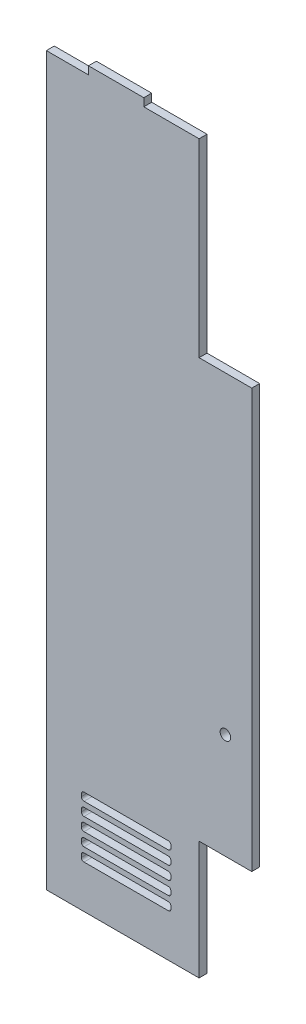
from build123d import *

# Parameters (mm, degrees)
SKETCH1_R           = 2
BOSS_EXTRUDE1_DEPTH = 3


with BuildPart() as part:
    # Sketch1 → Boss-Extrude1 (new body)
    with BuildSketch(Plane.XY):
        Polygon((18, -23.070954543), (18, 48.929045457), (-3, 48.929045457), (-3, 51.929045457), (-24, 51.929045457), (-24, 48.929045457), (-40, 48.929045457), (-40, -227.070954543), (18, -227.070954543), (18, -182.070954543), (38, -182.070954543), (38, -23.070954543), align=None)
        with BuildLine():
            Line((-25.70047512, -207.785634012), (6.29952488, -207.785634012))
            ThreePointArc((6.29952488, -207.785634012), (7.006631662, -208.078527231), (7.29952488, -208.785634012))
            Line((7.29952488, -208.785634012), (7.29952488, -209.785634012))
            ThreePointArc((7.29952488, -209.785634012), (7.006631662, -210.492740793), (6.29952488, -210.785634012))
            Line((6.29952488, -210.785634012), (-25.70047512, -210.785634012))
            ThreePointArc((-25.70047512, -210.785634012), (-26.407581901, -210.492740793), (-26.70047512, -209.785634012))
            Line((-26.70047512, -209.785634012), (-26.70047512, -208.785634012))
            ThreePointArc((-26.70047512, -208.785634012), (-26.407581901, -208.078527231), (-25.70047512, -207.785634012))
        make_face(mode=Mode.SUBTRACT)
        with BuildLine():
            Line((-25.70047512, -202.785634012), (6.29952488, -202.785634012))
            ThreePointArc((6.29952488, -202.785634012), (7.006631662, -203.078527231), (7.29952488, -203.785634012))
            Line((7.29952488, -203.785634012), (7.29952488, -204.785634012))
            ThreePointArc((7.29952488, -204.785634012), (7.006631662, -205.492740793), (6.29952488, -205.785634012))
            Line((6.29952488, -205.785634012), (-25.70047512, -205.785634012))
            ThreePointArc((-25.70047512, -205.785634012), (-26.407581901, -205.492740793), (-26.70047512, -204.785634012))
            Line((-26.70047512, -204.785634012), (-26.70047512, -203.785634012))
            ThreePointArc((-26.70047512, -203.785634012), (-26.407581901, -203.078527231), (-25.70047512, -202.785634012))
        make_face(mode=Mode.SUBTRACT)
        with BuildLine():
            Line((-25.70047512, -197.785634012), (6.29952488, -197.785634012))
            ThreePointArc((6.29952488, -197.785634012), (7.006631662, -198.078527231), (7.29952488, -198.785634012))
            Line((7.29952488, -198.785634012), (7.29952488, -199.785634012))
            ThreePointArc((7.29952488, -199.785634012), (7.006631662, -200.492740793), (6.29952488, -200.785634012))
            Line((6.29952488, -200.785634012), (-25.70047512, -200.785634012))
            ThreePointArc((-25.70047512, -200.785634012), (-26.407581901, -200.492740793), (-26.70047512, -199.785634012))
            Line((-26.70047512, -199.785634012), (-26.70047512, -198.785634012))
            ThreePointArc((-26.70047512, -198.785634012), (-26.407581901, -198.078527231), (-25.70047512, -197.785634012))
        make_face(mode=Mode.SUBTRACT)
        with BuildLine():
            Line((-25.70047512, -192.785634012), (6.29952488, -192.785634012))
            ThreePointArc((6.29952488, -192.785634012), (7.006631662, -193.078527231), (7.29952488, -193.785634012))
            Line((7.29952488, -193.785634012), (7.29952488, -194.785634012))
            ThreePointArc((7.29952488, -194.785634012), (7.006631662, -195.492740793), (6.29952488, -195.785634012))
            Line((6.29952488, -195.785634012), (-25.70047512, -195.785634012))
            ThreePointArc((-25.70047512, -195.785634012), (-26.407581901, -195.492740793), (-26.70047512, -194.785634012))
            Line((-26.70047512, -194.785634012), (-26.70047512, -193.785634012))
            ThreePointArc((-26.70047512, -193.785634012), (-26.407581901, -193.078527231), (-25.70047512, -192.785634012))
        make_face(mode=Mode.SUBTRACT)
        with BuildLine():
            Line((-25.70047512, -187.785634012), (6.29952488, -187.785634012))
            ThreePointArc((6.29952488, -187.785634012), (7.006631662, -188.078527231), (7.29952488, -188.785634012))
            Line((7.29952488, -188.785634012), (7.29952488, -189.785634012))
            ThreePointArc((7.29952488, -189.785634012), (7.006631662, -190.492740793), (6.29952488, -190.785634012))
            Line((6.29952488, -190.785634012), (-25.70047512, -190.785634012))
            ThreePointArc((-25.70047512, -190.785634012), (-26.407581901, -190.492740793), (-26.70047512, -189.785634012))
            Line((-26.70047512, -189.785634012), (-26.70047512, -188.785634012))
            ThreePointArc((-26.70047512, -188.785634012), (-26.407581901, -188.078527231), (-25.70047512, -187.785634012))
        make_face(mode=Mode.SUBTRACT)
        with Locations((28, -142.070954543)):
            Circle(SKETCH1_R, mode=Mode.SUBTRACT)
    extrude(amount=BOSS_EXTRUDE1_DEPTH)


solid = part.part
